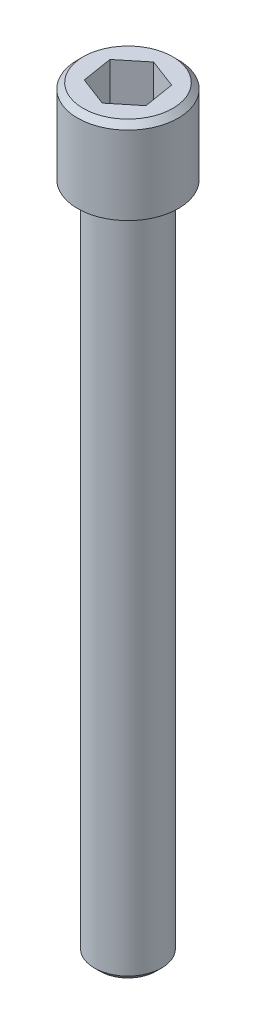
from build123d import *

# Parameters (mm, degrees)
SKICA1_R                 = 1.5
P_IDAT_VYSUNUT_M1_DEPTH  = 30
SKICA2_R                 = 2.25
P_IDAT_VYSUNUT_M2_DEPTH  = 3.75
ODEBRAT_VYSUNUT_M1_DEPTH = 2.25
ZKOSEN_1_SIZE            = 0.25
ZKOSEN_2_SIZE            = 0.25


with BuildPart() as part:
    # Skica1 → Přidat vysunutím1 (new body)
    with BuildSketch(Plane(origin=(0, 0, 0), x_dir=(1, 0, 0), z_dir=(0, 1, 0))):
        with Locations(Location((0, 0, 0), (0, 0, 270))):
            Circle(SKICA1_R)
    extrude(amount=P_IDAT_VYSUNUT_M1_DEPTH)

    # Skica2 → Přidat vysunutím2 (add)
    with BuildSketch(Plane(origin=(0, 30, 0), x_dir=(1, 0, 0), z_dir=(0, 1, 0))):
        with Locations(Location((0, 0, 0), (0, 0, 270))):
            Circle(SKICA2_R)
    extrude(amount=P_IDAT_VYSUNUT_M2_DEPTH)

    # Skica3 → Odebrat vysunutím1 (cut)
    with BuildSketch(Plane(origin=(0, 33.75, 0), x_dir=(1, 0, 0), z_dir=(0, 1, 0))):
        Polygon((-1.074402598, -0.875019461), (0.220587783, -1.367969674), (1.294990381, -0.492950213), (1.074402598, 0.875019461), (-0.220587783, 1.367969674), (-1.294990381, 0.492950213), align=None)
    extrude(amount=-ODEBRAT_VYSUNUT_M1_DEPTH, mode=Mode.SUBTRACT)

    # Zkosení1
    zkosen_1_edges = [part.edges().sort_by_distance(p)[0] for p in [
        (0, 33.75, -2.25),
    ]]
    chamfer(zkosen_1_edges, length=ZKOSEN_1_SIZE)

    # Zkosení2
    zkosen_2_edges = [part.edges().sort_by_distance(p)[0] for p in [
        (0, 0, -1.5),
    ]]
    chamfer(zkosen_2_edges, length=ZKOSEN_2_SIZE)


solid = part.part
